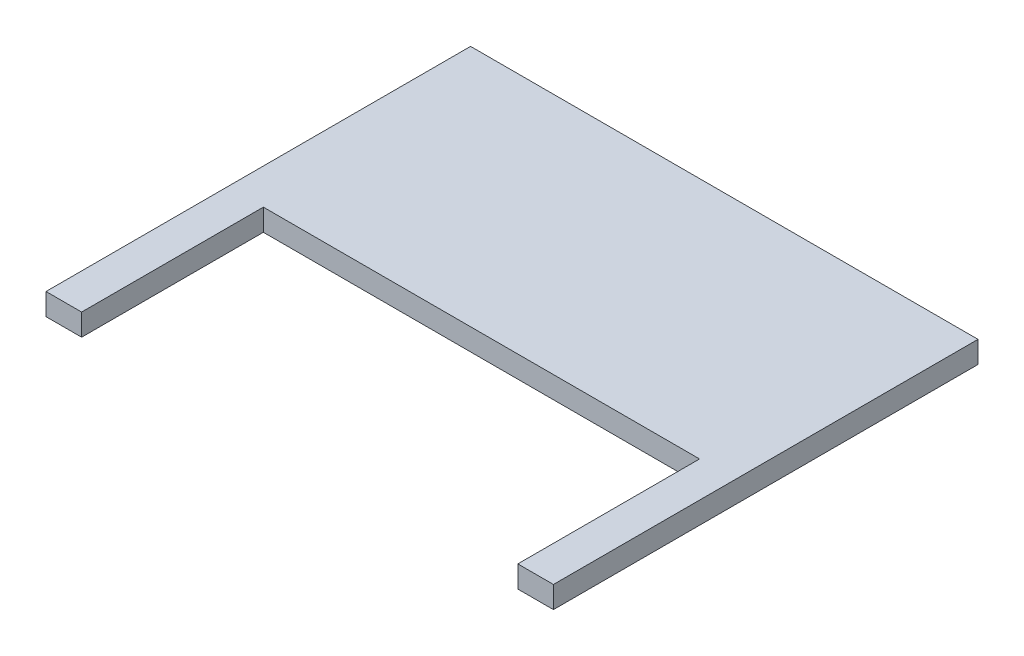
from build123d import *

# Parameters (mm, degrees)
BOSS_EXTRUDE1_DEPTH = 3


with BuildPart() as part:
    # Sketch1 → Boss-Extrude1 (new body)
    with BuildSketch(Plane(origin=(0, 0, 0), x_dir=(1, 0, 0), z_dir=(0, 1, 0))):
        Polygon((69.8, 0), (0, 0), (0, -58.4), (4.9, -58.4), (4.9, -33.4), (64.9, -33.4), (64.9, -58.4), (69.8, -58.4), align=None)
    extrude(amount=BOSS_EXTRUDE1_DEPTH)


solid = part.part
